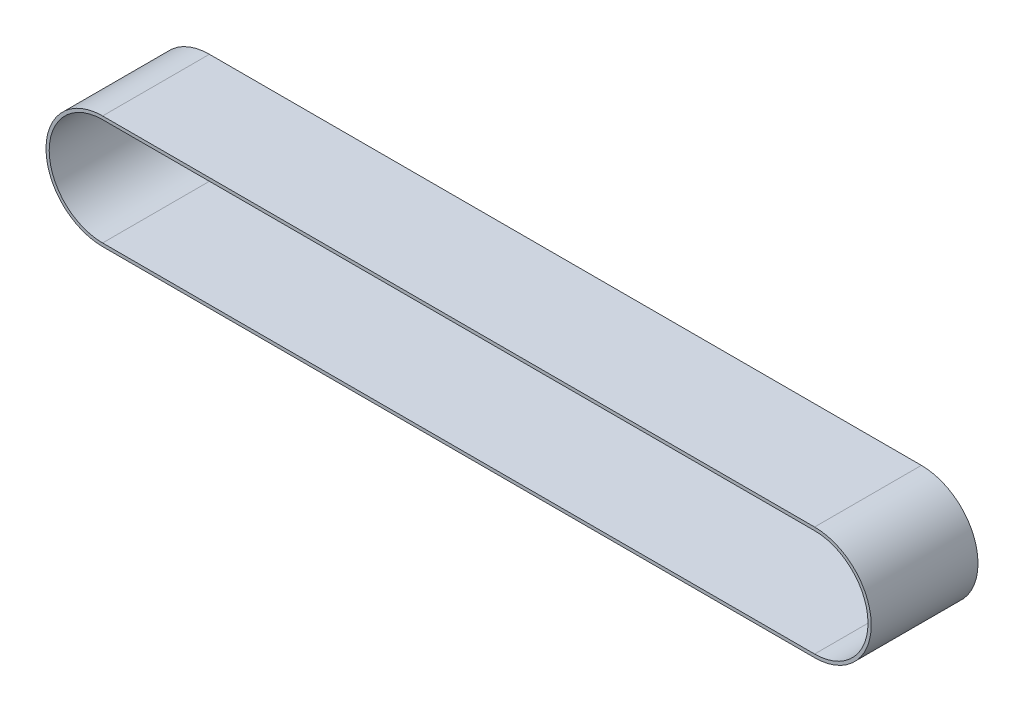
from build123d import *

# Parameters (mm, degrees)
EXTRUDE_1_DEPTH = 30


with BuildPart() as part:
    # 草图1 → 凸台-拉伸1 (new body)
    with BuildSketch(Plane.XY):
        with BuildLine():
            Line((0, -15.9), (200, -15.9))
            ThreePointArc((200, -15.9), (215.9, 0), (200, 15.9))
            Line((200, 15.9), (0, 15.9))
            ThreePointArc((0, 15.9), (-15.9, 0), (0, -15.9))
        make_face()
        with BuildLine():
            Line((0, -15), (200, -15))
            ThreePointArc((200, -15), (215, 0), (200, 15))
            Line((200, 15), (0, 15))
            ThreePointArc((0, 15), (-15, 0), (0, -15))
        make_face(mode=Mode.SUBTRACT)
    extrude(amount=EXTRUDE_1_DEPTH)


solid = part.part
